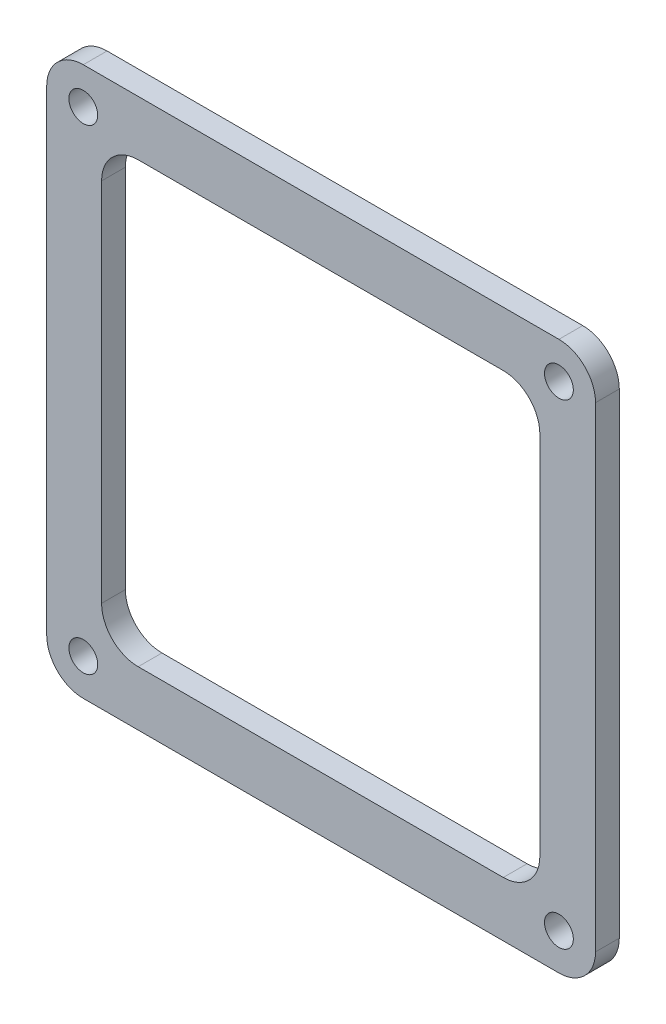
from build123d import *

# Parameters (mm, degrees)
MODEL_R         = 1.575
EXTRUDE_1_DEPTH = 2.6


with BuildPart() as part:
    # Model → 凸台-拉伸1 (new body)
    with BuildSketch(Plane.XY):
        with BuildLine():
            Line((2267.087112804, 1815.358905475), (2267.087112804, 1763.358905475))
            ThreePointArc((2267.087112804, 1763.358905475), (2268.25868568, 1760.53047835), (2271.087112804, 1759.358905475))
            Line((2271.087112804, 1759.358905475), (2323.087112804, 1759.358905475))
            ThreePointArc((2323.087112804, 1759.358905475), (2325.915539929, 1760.53047835), (2327.087112804, 1763.358905475))
            Line((2327.087112804, 1763.358905475), (2327.087112804, 1815.358905475))
            ThreePointArc((2327.087112804, 1815.358905475), (2325.915539929, 1818.187332599), (2323.087112804, 1819.358905475))
            Line((2323.087112804, 1819.358905475), (2271.087112804, 1819.358905475))
            ThreePointArc((2271.087112804, 1819.358905475), (2268.25868568, 1818.187332599), (2267.087112804, 1815.358905475))
        make_face()
        with Locations((2271.087112804, 1763.358905475)):
            Circle(MODEL_R, mode=Mode.SUBTRACT)
        with Locations((2323.087112804, 1763.358905475)):
            Circle(MODEL_R, mode=Mode.SUBTRACT)
        with Locations((2271.087112804, 1815.358905475)):
            Circle(MODEL_R, mode=Mode.SUBTRACT)
        with Locations((2323.087112804, 1815.358905475)):
            Circle(MODEL_R, mode=Mode.SUBTRACT)
        with BuildLine():
            Line((2295.483483019, 1813.357611428), (2317.000502455, 1813.357611428))
            ThreePointArc((2317.000502455, 1813.357611428), (2319.828929579, 1812.186038553), (2321.000502455, 1809.357611428))
            Line((2321.000502455, 1809.357611428), (2321.000502455, 1769.362445027))
            ThreePointArc((2321.000502455, 1769.362445027), (2319.828929579, 1766.534017903), (2317.000502455, 1765.362445027))
            Line((2317.000502455, 1765.362445027), (2277.087112804, 1765.362445027))
            ThreePointArc((2277.087112804, 1765.362445027), (2274.25868568, 1766.534017903), (2273.087112804, 1769.362445027))
            Line((2273.087112804, 1769.362445027), (2273.087112804, 1809.357611428))
            ThreePointArc((2273.087112804, 1809.357611428), (2274.25868568, 1812.186038553), (2277.087112804, 1813.357611428))
            Line((2277.087112804, 1813.357611428), (2295.483483019, 1813.357611428))
        make_face(mode=Mode.SUBTRACT)
    extrude(amount=EXTRUDE_1_DEPTH)


solid = part.part
